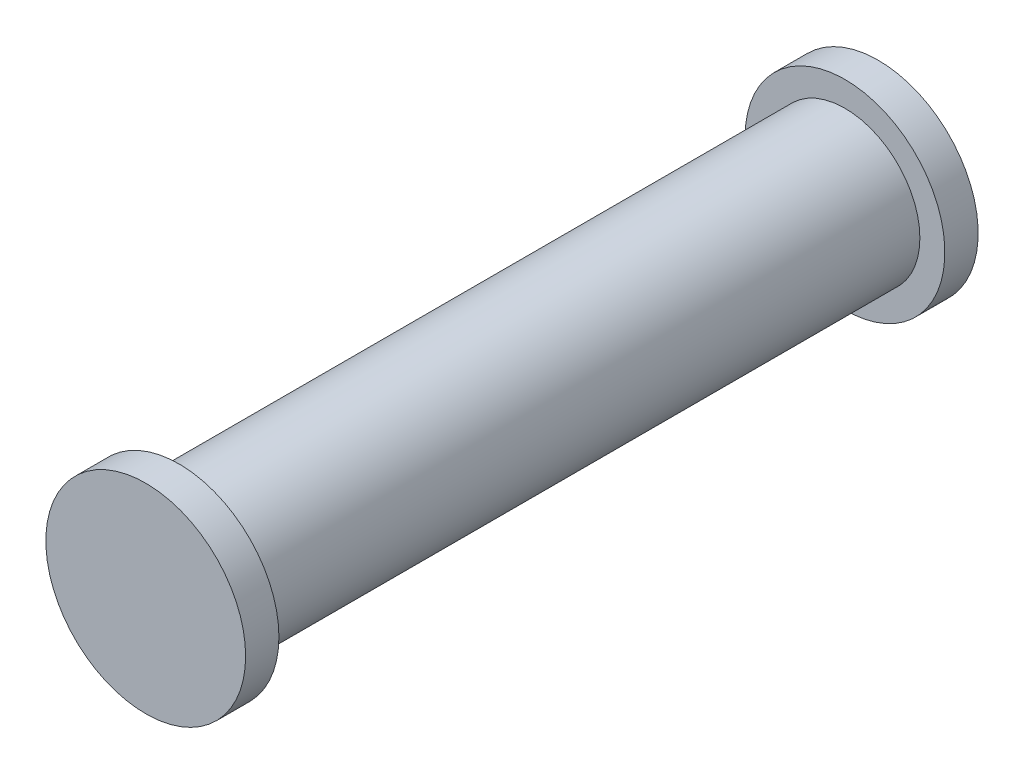
from build123d import *

# Parameters (mm, degrees)
SKIZZE1_R                       = 2.25
AUFSATZ_LINEAR_AUSTRAGEN1_DEPTH = 20
SKIZZE2_R                       = 3
AUFSATZ_LINEAR_AUSTRAGEN2_DEPTH = 1
AUFSATZ_LINEAR_START            = 1
SKIZZE3_R                       = 3
AUFSATZ_LINEAR_AUSTRAGEN3_DEPTH = 1


with BuildPart() as part:
    # Skizze1 → Aufsatz-Linear austragen1 (new body)
    with BuildSketch(Plane.XY):
        with Locations((-14.9, 25)):
            Circle(SKIZZE1_R)
    extrude(amount=-AUFSATZ_LINEAR_AUSTRAGEN1_DEPTH)

    # Skizze2 → Aufsatz-Linear austragen2 (add)
    with BuildSketch(Plane.XY):
        with Locations((-14.9, 25)):
            Circle(SKIZZE2_R)
    extrude(amount=AUFSATZ_LINEAR_AUSTRAGEN2_DEPTH)

    # Skizze3 → Aufsatz-Linear austragen3 (add)
    with BuildSketch(Plane(origin=(0, 0, -20), x_dir=(-1, 0, 0), z_dir=(0, 0, -1)).offset(AUFSATZ_LINEAR_START)):
        with Locations(Location((14.9, 25, 0), (0, 0, 180))):
            Circle(SKIZZE3_R)
    extrude(amount=-AUFSATZ_LINEAR_AUSTRAGEN3_DEPTH)


solid = part.part
